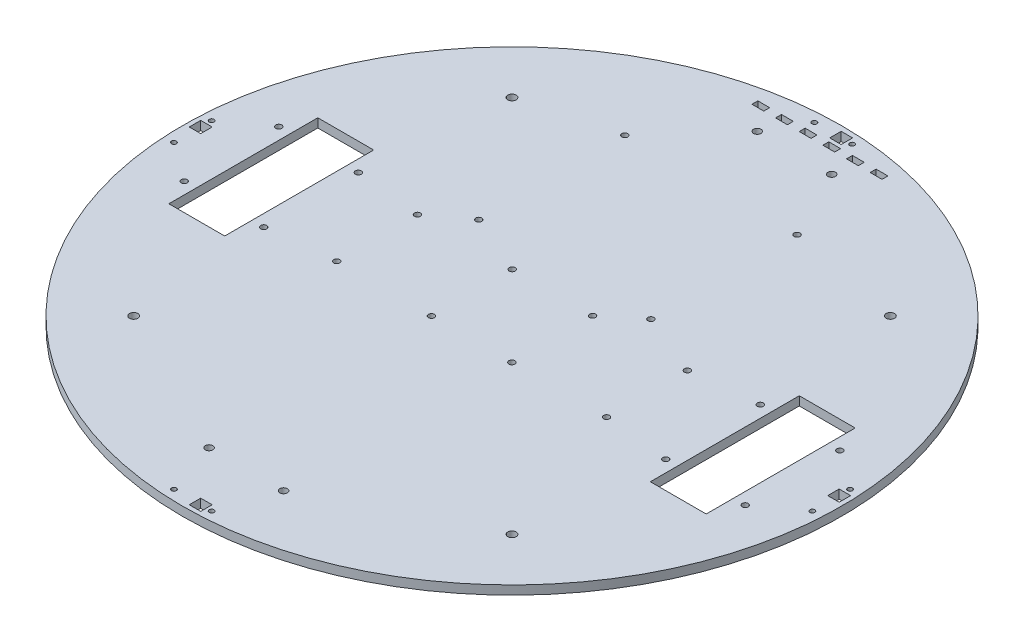
from build123d import *

# Parameters (mm, degrees)
SKETCH1_R           = 177
SKETCH1_R_2         = 1.6
SKETCH1_R_3         = 2.2479
SKETCH1_R_4         = 2.000000064
SKETCH1_R_5         = 1.3
SKETCH1_R_6         = 1.29999994
SKETCH1_W           = 6.15
SKETCH1_H           = 6.15
SKETCH1_W_2         = 30
SKETCH1_H_2         = 80
SKETCH1_W_3         = 6.35
SKETCH1_H_3         = 3.175
BOSS_EXTRUDE1_DEPTH = 4.7625
SKETCH2_R           = 1.599999975
CUT_EXTRUDE1_DEPTH  = 251.361102023
SKETCH3_R           = 1.3
SKETCH3_R_2         = 1.29999994
SKETCH3_W           = 6.15
SKETCH3_H           = 6.15
CUT_EXTRUDE2_DEPTH  = 251.361102023


with BuildPart() as part:
    # Sketch1 → Boss-Extrude1 (new body)
    with BuildSketch(Plane(origin=(0, 0, 0), x_dir=(1, 0, 0), z_dir=(0, 1, 0))):
        with Locations(Location((0, 0, 0), (0, 0, 90))):
            Circle(SKETCH1_R)
        with Locations(Location((-150.65, 25.4, 0), (0, 0, 90))):
            Circle(SKETCH1_R_2, mode=Mode.SUBTRACT)
        with Locations(Location((-150.65, -25.4, 0), (0, 0, 90))):
            Circle(SKETCH1_R_2, mode=Mode.SUBTRACT)
        with Locations(Location((150.65, 25.4, 0), (0, 0, 90))):
            Circle(SKETCH1_R_2, mode=Mode.SUBTRACT)
        with Locations(Location((150.65, -25.4, 0), (0, 0, 90))):
            Circle(SKETCH1_R_2, mode=Mode.SUBTRACT)
        with Locations(Location((-107.95, 25.4, 0), (0, 0, 90))):
            Circle(SKETCH1_R_2, mode=Mode.SUBTRACT)
        with Locations(Location((-107.95, -25.4, 0), (0, 0, 90))):
            Circle(SKETCH1_R_2, mode=Mode.SUBTRACT)
        with Locations(Location((107.95, 25.4, 0), (0, 0, 90))):
            Circle(SKETCH1_R_2, mode=Mode.SUBTRACT)
        with Locations(Location((107.95, -25.4, 0), (0, 0, 90))):
            Circle(SKETCH1_R_2, mode=Mode.SUBTRACT)
        with Locations(Location((-53.7, 114.3, 0), (0, 0, 90))):
            Circle(SKETCH1_R_2, mode=Mode.SUBTRACT)
        with Locations(Location((38.8, 114.3, 0), (0, 0, 90))):
            Circle(SKETCH1_R_2, mode=Mode.SUBTRACT)
        with Locations(Location((-53.7, 35.8, 0), (0, 0, 90))):
            Circle(SKETCH1_R_2, mode=Mode.SUBTRACT)
        with Locations(Location((38.8, 35.8, 0), (0, 0, 90))):
            Circle(SKETCH1_R_2, mode=Mode.SUBTRACT)
        with Locations(Location((-101.6, -101.6, 0), (0, 0, 90))):
            Circle(SKETCH1_R_3, mode=Mode.SUBTRACT)
        with Locations(Location((101.6, -101.6, 0), (0, 0, 90))):
            Circle(SKETCH1_R_3, mode=Mode.SUBTRACT)
        with Locations(Location((-101.6, 101.6, 0), (0, 0, 90))):
            Circle(SKETCH1_R_3, mode=Mode.SUBTRACT)
        with Locations(Location((101.6, 101.6, 0), (0, 0, 90))):
            Circle(SKETCH1_R_3, mode=Mode.SUBTRACT)
        with Locations(Location((-20, -142.687006289, 0), (0, 0, 90))):
            Circle(SKETCH1_R_4, mode=Mode.SUBTRACT)
        with Locations(Location((20, -142.687006289, 0), (0, 0, 90))):
            Circle(SKETCH1_R_4, mode=Mode.SUBTRACT)
        with Locations(Location((-20, 151.719279026, 0), (0, 0, 90))):
            Circle(SKETCH1_R_4, mode=Mode.SUBTRACT)
        with Locations(Location((20, 151.719279026, 0), (0, 0, 90))):
            Circle(SKETCH1_R_4, mode=Mode.SUBTRACT)
        with Locations(Location((-10.125, -171.45, 0), (0, 0, 90))):
            Circle(SKETCH1_R_5, mode=Mode.SUBTRACT)
        with Locations(Location((10.125, -171.45, 0), (0, 0, 90))):
            Circle(SKETCH1_R_6, mode=Mode.SUBTRACT)
        with Locations(Location((171.45, -10.125, 0), (0, 0, 90))):
            Circle(SKETCH1_R_5, mode=Mode.SUBTRACT)
        with Locations(Location((171.45, 10.125, 0), (0, 0, 90))):
            Circle(SKETCH1_R_5, mode=Mode.SUBTRACT)
        with Locations(Location((-171.45, -10.125, 0), (0, 0, 90))):
            Circle(SKETCH1_R_5, mode=Mode.SUBTRACT)
        with Locations(Location((-171.45, 10.125, 0), (0, 0, 90))):
            Circle(SKETCH1_R_5, mode=Mode.SUBTRACT)
        with Locations((171.45, 4.26)):
            Rectangle(SKETCH1_W, SKETCH1_H, mode=Mode.SUBTRACT)
        with Locations((-129.3, 0)):
            Rectangle(SKETCH1_W_2, SKETCH1_H_2, mode=Mode.SUBTRACT)
        with Locations((129.3, 0)):
            Rectangle(SKETCH1_W_2, SKETCH1_H_2, mode=Mode.SUBTRACT)
        with Locations((4.26, -171.45)):
            Rectangle(SKETCH1_W, SKETCH1_H, mode=Mode.SUBTRACT)
        with Locations((-171.45, 4.26)):
            Rectangle(SKETCH1_W, SKETCH1_H, mode=Mode.SUBTRACT)
        with Locations((-18.119952608, 164.452014647)):
            Rectangle(SKETCH1_W_3, SKETCH1_H_3, mode=Mode.SUBTRACT)
        with Locations((-30.819952608, 164.452014647)):
            Rectangle(SKETCH1_W_3, SKETCH1_H_3, mode=Mode.SUBTRACT)
        with Locations((-5.419952608, 164.452014647)):
            Rectangle(SKETCH1_W_3, SKETCH1_H_3, mode=Mode.SUBTRACT)
        with Locations((7.280047392, 164.452014647)):
            Rectangle(SKETCH1_W_3, SKETCH1_H_3, mode=Mode.SUBTRACT)
        with Locations((19.980047392, 164.452014647)):
            Rectangle(SKETCH1_W_3, SKETCH1_H_3, mode=Mode.SUBTRACT)
        with Locations((32.680047392, 164.452014647)):
            Rectangle(SKETCH1_W_3, SKETCH1_H_3, mode=Mode.SUBTRACT)
    extrude(amount=BOSS_EXTRUDE1_DEPTH)

    # Sketch2 → Cut-Extrude1 (cut, through all)
    with BuildSketch(Plane(origin=(0, 4.7625, 0), x_dir=(1, 0, 0), z_dir=(0, 1, 0))):
        with Locations(Location((21.59, 21.689999946, 0), (0, 0, 270))):
            Circle(SKETCH2_R)
        with Locations(Location((21.59, -21.690000054, 0), (0, 0, 270))):
            Circle(SKETCH2_R)
        with Locations(Location((72.470000006, -21.690000054, 0), (0, 0, 270))):
            Circle(SKETCH2_R)
        with Locations(Location((72.470000006, 21.689999946, 0), (0, 0, 270))):
            Circle(SKETCH2_R)
        with Locations(Location((-72.470000006, 21.689999946, 0), (0, 0, 270))):
            Circle(SKETCH2_R)
        with Locations(Location((-72.470000006, -21.690000054, 0), (0, 0, 270))):
            Circle(SKETCH2_R)
        with Locations(Location((-21.59, -21.690000054, 0), (0, 0, 270))):
            Circle(SKETCH2_R)
        with Locations(Location((-21.59, 21.689999946, 0), (0, 0, 270))):
            Circle(SKETCH2_R)
    extrude(amount=-CUT_EXTRUDE1_DEPTH, mode=Mode.SUBTRACT)

    # Sketch3 → Cut-Extrude2 (cut, through all)
    with BuildSketch(Plane(origin=(0, 4.7625, 0), x_dir=(1, 0, 0), z_dir=(0, 1, 0))):
        with Locations(Location((-8.77, 171.169, 0), (0, 0, 270))):
            Circle(SKETCH3_R)
        with Locations(Location((11.48, 171.169, 0), (0, 0, 270))):
            Circle(SKETCH3_R_2)
        with Locations((5.615, 171.169)):
            Rectangle(SKETCH3_W, SKETCH3_H)
    extrude(amount=-CUT_EXTRUDE2_DEPTH, mode=Mode.SUBTRACT)


solid = part.part
